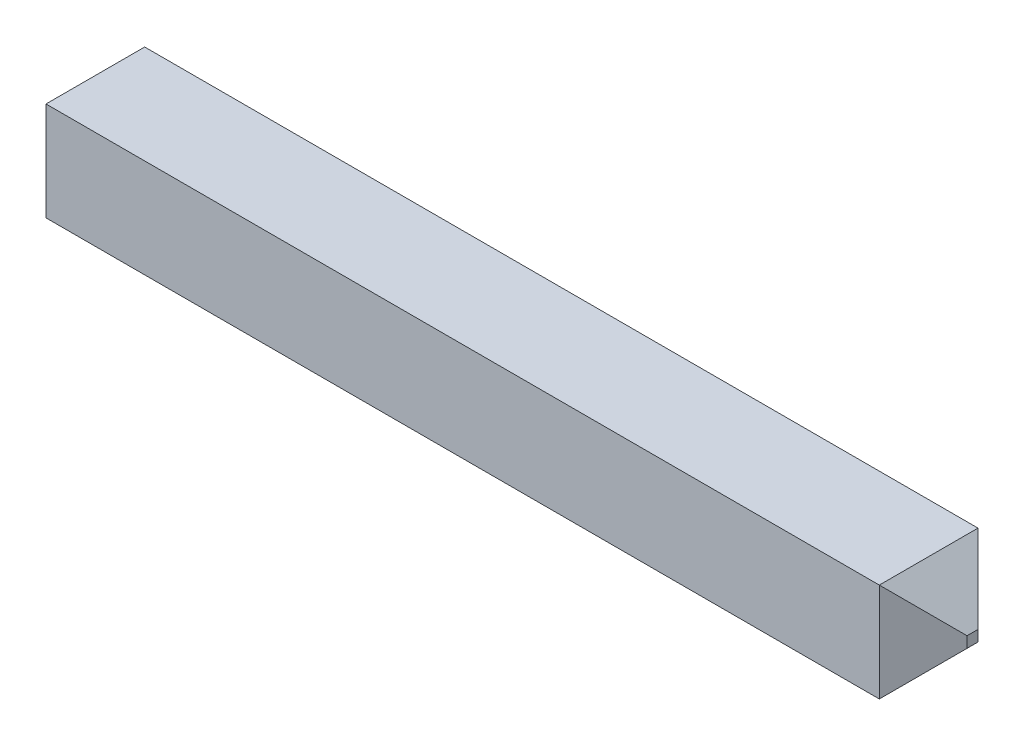
from build123d import *

# Parameters (mm, degrees)
CROQUIS1_W              = 4
CROQUIS1_H              = 0.45
SALIENTE_EXTRUIR1_DEPTH = 0.45
CHAFL_N1_SIZE           = 0.2


with BuildPart() as part:
    # Croquis1 → Saliente-Extruir1 (new body)
    with BuildSketch(Plane(origin=(0, 0, -0.225), x_dir=(-1, 0, 0), z_dir=(0, 0, -1))):
        with Locations((-2, 0)):
            Rectangle(CROQUIS1_W, CROQUIS1_H)
    extrude(amount=-SALIENTE_EXTRUIR1_DEPTH)

    # Chaflán1
    chafl_n1_edges = [part.edges().sort_by_distance(p)[0] for p in [
        (4, 0, 0.225),
        (4, 0, -0.225),
        (4, -0.225, 0),
        (4, 0.225, 0),
    ]]
    chamfer(chafl_n1_edges, length=CHAFL_N1_SIZE)


solid = part.part
